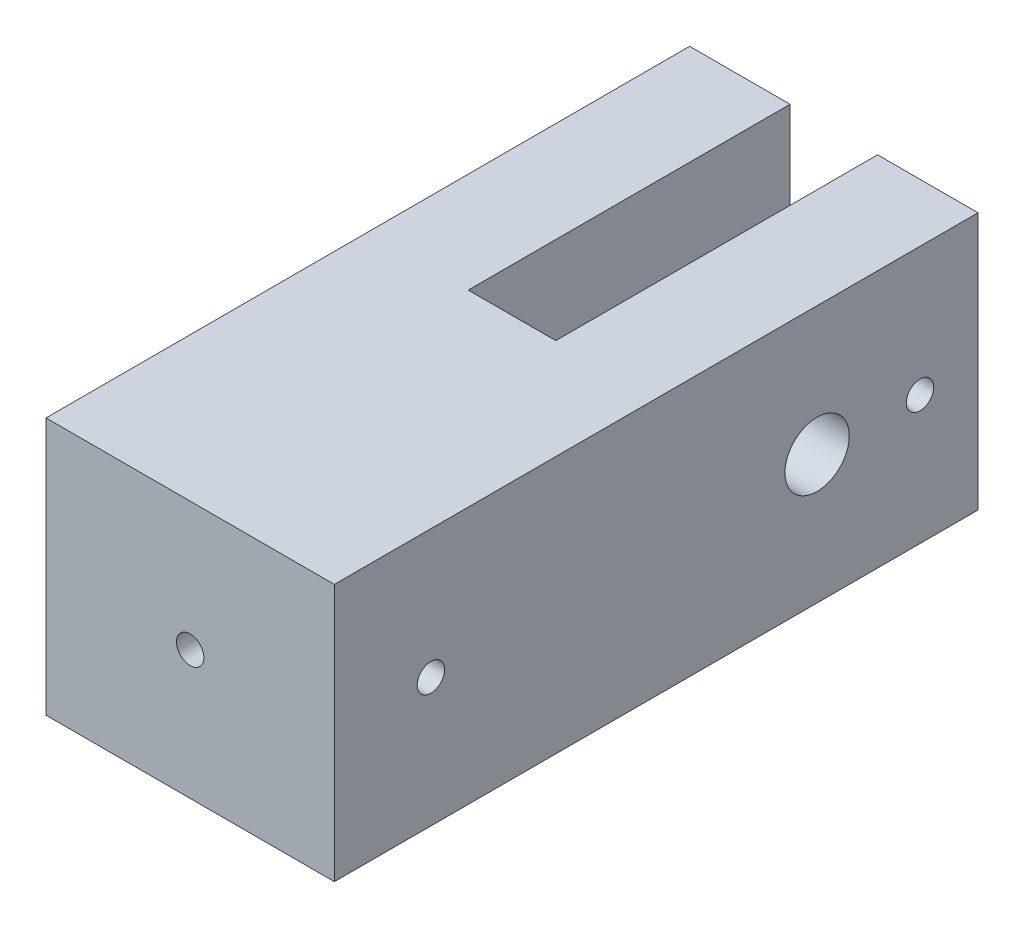
from build123d import *

# Parameters (mm, degrees)
SKETCH1_W                 = 28.448
SKETCH1_H                 = 25.4
BOSS_EXTRUDE1_DEPTH       = 63.5
SKETCH2_W                 = 8.636
SKETCH2_H                 = 31.75
CUT_EXTRUDE1_DEPTH        = 70.855079815
SKETCH3_R                 = 3.175
CUT_EXTRUDE3_DEPTH        = 71.730677248
F_6_32_TAPPED_HOLE1_D     = 2.7051
F_6_32_TAPPED_HOLE1_DEPTH = 6.35
F_6_32_TAPPED_HOLE1_TIP   = 0.81269403
F_6_32_TAPPED_HOLE2_D     = 2.7051
F_6_32_TAPPED_HOLE2_DEPTH = 6.35
F_6_32_TAPPED_HOLE2_TIP   = 0.81269403
F_6_32_TAPPED_HOLE3_D     = 2.7051


with BuildPart() as part:
    # Sketch1 → Boss-Extrude1 (new body)
    with BuildSketch(Plane.XY):
        Rectangle(SKETCH1_W, SKETCH1_H)
    extrude(amount=BOSS_EXTRUDE1_DEPTH)

    # Sketch2 → Cut-Extrude1 (cut, through all)
    with BuildSketch(Plane(origin=(0, 12.7, 0), x_dir=(1, 0, 0), z_dir=(0, 1, 0))):
        with Locations((0, -15.875)):
            Rectangle(SKETCH2_W, SKETCH2_H)
    extrude(amount=-CUT_EXTRUDE1_DEPTH, mode=Mode.SUBTRACT)

    # Sketch3 → Cut-Extrude3 (cut, through all)
    with BuildSketch(Plane.ZY.offset(14.224)):
        with Locations((15.875, 0)):
            Circle(SKETCH3_R)
    extrude(amount=-CUT_EXTRUDE3_DEPTH, mode=Mode.SUBTRACT)

    # #6-32 Tapped Hole1
    with Locations(Plane.ZY.offset(14.224)):
        with Locations((5.715, 0), (53.975, 0)):
            Hole(F_6_32_TAPPED_HOLE1_D / 2, depth=F_6_32_TAPPED_HOLE1_DEPTH)
            with Locations((0, 0, -(F_6_32_TAPPED_HOLE1_DEPTH + F_6_32_TAPPED_HOLE1_TIP / 2))):  # 118° drill point
                Cone(0, F_6_32_TAPPED_HOLE1_D / 2, F_6_32_TAPPED_HOLE1_TIP, mode=Mode.SUBTRACT)

    # #6-32 Tapped Hole2
    with Locations(Plane(origin=(14.224, 0, 0), x_dir=(0, 0, -1), z_dir=(1, 0, 0))):
        with Locations((-53.975, 0), (-5.715, 0)):
            Hole(F_6_32_TAPPED_HOLE2_D / 2, depth=F_6_32_TAPPED_HOLE2_DEPTH)
            with Locations((0, 0, -(F_6_32_TAPPED_HOLE2_DEPTH + F_6_32_TAPPED_HOLE2_TIP / 2))):  # 118° drill point
                Cone(0, F_6_32_TAPPED_HOLE2_D / 2, F_6_32_TAPPED_HOLE2_TIP, mode=Mode.SUBTRACT)

    # #6-32 Tapped Hole3 (through all)
    with Locations(Plane(origin=(0, 0, 31.75), x_dir=(-1, 0, 0), z_dir=(0, 0, -1))):
        with Locations((0, 0)):
            Hole(F_6_32_TAPPED_HOLE3_D / 2)


solid = part.part
